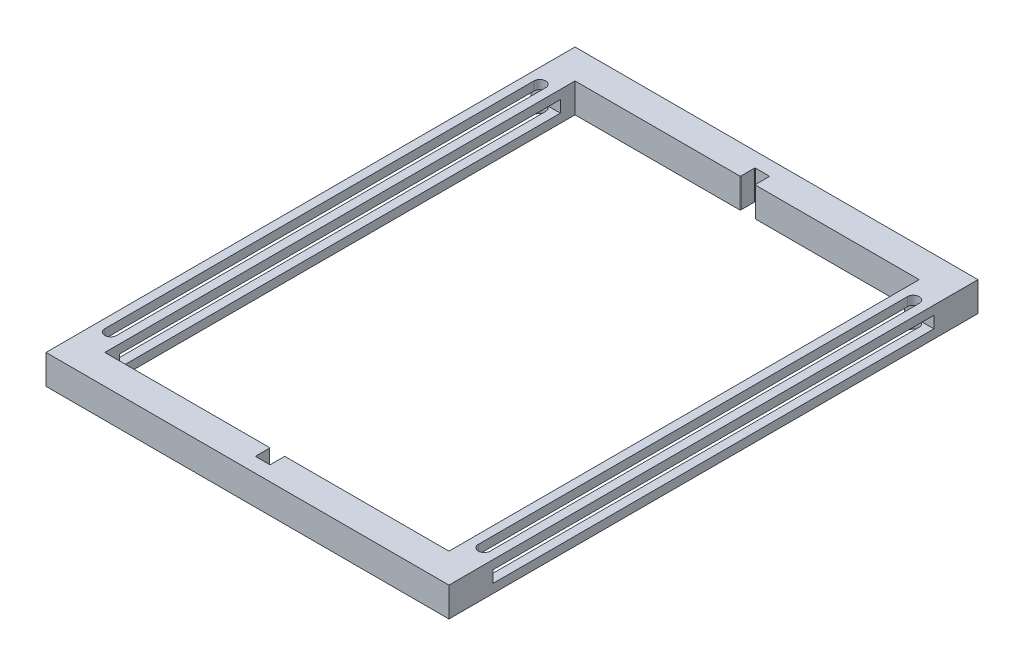
from build123d import *

# Parameters (mm, degrees)
SKETCH1_W           = 137.099988832
SKETCH1_H           = 180
BOSS_EXTRUDE1_DEPTH = 10
SKETCH2_W           = 150
SKETCH2_H           = 4
CUT_EXTRUDE1_DEPTH  = 160


with BuildPart() as part:
    # Sketch1 → Boss-Extrude1 (new body)
    with BuildSketch(Plane(origin=(0, 0, 0), x_dir=(1, 0, 0), z_dir=(0, 1, 0))):
        with Locations((74.75359819, -81.23781213)):
            Rectangle(SKETCH1_W, SKETCH1_H)
        with BuildLine():
            Line((16.203603774, -1.23781213), (72.1788033, -1.23781213))
            ThreePointArc((72.1788033, -1.23781213), (72.355579995, -1.164588825), (72.4288033, -0.98781213))
            Line((72.4288033, -0.98781213), (72.4288033, 3.51218787))
            ThreePointArc((72.4288033, 3.51218787), (72.502026605, 3.688964566), (72.6788033, 3.76218787))
            Line((72.6788033, 3.76218787), (77.1788033, 3.76218787))
            ThreePointArc((77.1788033, 3.76218787), (77.355579995, 3.688964566), (77.4288033, 3.51218787))
            Line((77.4288033, 3.51218787), (77.4288033, -0.98781213))
            ThreePointArc((77.4288033, -0.98781213), (77.502026605, -1.164588825), (77.6788033, -1.23781213))
            Line((77.6788033, -1.23781213), (133.303592606, -1.23781213))
            Line((133.303592606, -1.23781213), (133.303592606, -161.23781213))
            Line((133.303592606, -161.23781213), (77.6788033, -161.23781213))
            ThreePointArc((77.6788033, -161.23781213), (77.502026605, -161.311035434), (77.4288033, -161.48781213))
            Line((77.4288033, -161.48781213), (77.4288033, -165.98781213))
            ThreePointArc((77.4288033, -165.98781213), (77.355579995, -166.164588825), (77.1788033, -166.23781213))
            Line((77.1788033, -166.23781213), (72.6788033, -166.23781213))
            ThreePointArc((72.6788033, -166.23781213), (72.502026605, -166.164588825), (72.4288033, -165.98781213))
            Line((72.4288033, -165.98781213), (72.4288033, -161.48781213))
            ThreePointArc((72.4288033, -161.48781213), (72.355579995, -161.311035434), (72.1788033, -161.23781213))
            Line((72.1788033, -161.23781213), (16.203603774, -161.23781213))
            Line((16.203603774, -161.23781213), (16.203603774, -1.23781213))
        make_face(mode=Mode.SUBTRACT)
        with BuildLine():
            Line((9.203603774, -154.23781213), (9.203603774, -8.23781213))
            ThreePointArc((9.203603774, -8.23781213), (11.203603774, -6.23781213), (13.203603774, -8.23781213))
            Line((13.203603774, -8.23781213), (13.203603774, -154.23781213))
            ThreePointArc((13.203603774, -154.23781213), (11.203603774, -156.23781213), (9.203603774, -154.23781213))
        make_face(mode=Mode.SUBTRACT)
        with BuildLine():
            Line((136.303592606, -154.23781213), (136.303592606, -8.23781213))
            ThreePointArc((136.303592606, -8.23781213), (138.303592606, -6.23781213), (140.303592606, -8.23781213))
            Line((140.303592606, -8.23781213), (140.303592606, -154.23781213))
            ThreePointArc((140.303592606, -154.23781213), (138.303592606, -156.23781213), (136.303592606, -154.23781213))
        make_face(mode=Mode.SUBTRACT)
    extrude(amount=BOSS_EXTRUDE1_DEPTH)

    # Sketch2 → Cut-Extrude1 (cut)
    with BuildSketch(Plane(origin=(143.303592606, 0, 0), x_dir=(0, 0, -1), z_dir=(1, 0, 0))):
        with Locations((-81.23781213, 5)):
            Rectangle(SKETCH2_W, SKETCH2_H)
    extrude(amount=-CUT_EXTRUDE1_DEPTH, mode=Mode.SUBTRACT)


solid = part.part
